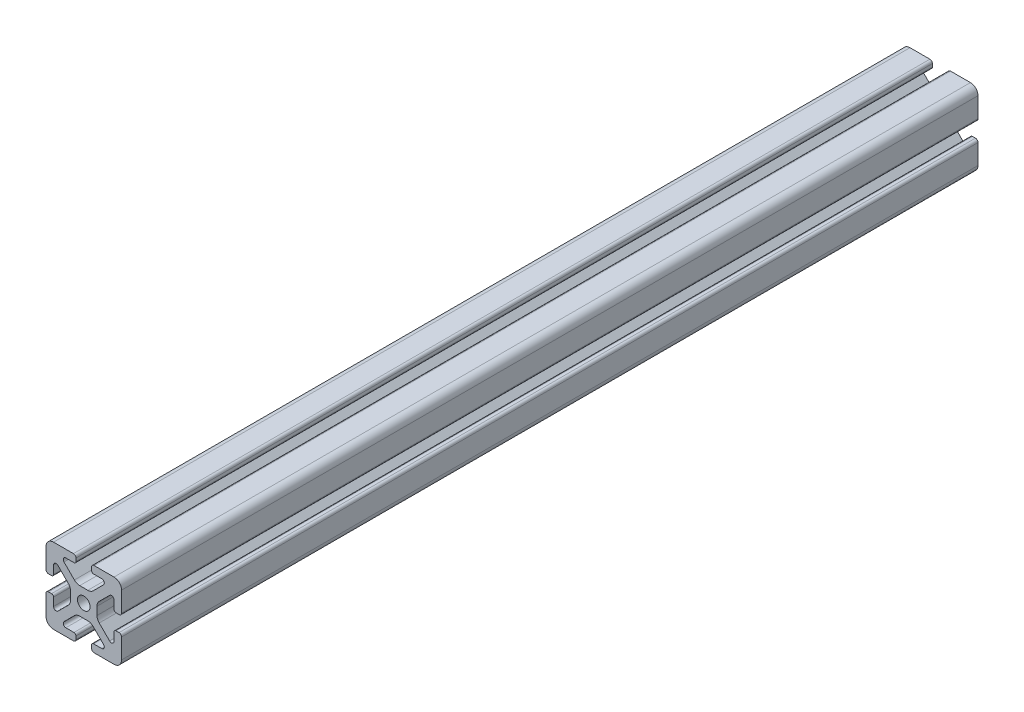
from build123d import *

# Parameters (mm, degrees)
BOSS_EXTRU_1_DEPTH = 340


with BuildPart() as part:
    # Esquisse1 → Boss.-Extru.1 (new body)
    with BuildSketch(Plane.XY):
        with BuildLine():
            Line((-5.250000005, 1.60319626), (-5.250000005, -1.60319626))
            ThreePointArc((-5.250000005, -1.60319626), (-5.478361407, -2.751246556), (-6.128679661, -3.724516602))
            Line((-6.128679661, -3.724516602), (-10.254720421, -7.850557362))
            ThreePointArc((-10.254720421, -7.850557362), (-11.36887955, -8.072177392), (-12, -7.12763889))
            Line((-12, -7.12763889), (-12, -3.9))
            ThreePointArc((-12, -3.9), (-12.234314575, -3.334314575), (-12.8, -3.1))
            Line((-12.8, -3.1), (-14, -3.1))
            ThreePointArc((-14, -3.1), (-14.707106781, -3.392893219), (-15, -4.1))
            Line((-15, -4.1), (-15, -12))
            ThreePointArc((-15, -12), (-14.121320344, -14.121320344), (-12, -15))
            Line((-12, -15), (-4.1, -15))
            ThreePointArc((-4.1, -15), (-3.392893219, -14.707106781), (-3.1, -14))
            Line((-3.1, -14), (-3.1, -12.8))
            ThreePointArc((-3.1, -12.8), (-3.334314575, -12.234314575), (-3.9, -12))
            Line((-3.9, -12), (-7.12763889, -12))
            ThreePointArc((-7.12763889, -12), (-8.072177392, -11.36887955), (-7.850557362, -10.254720421))
            Line((-7.850557362, -10.254720421), (-3.724516602, -6.128679661))
            ThreePointArc((-3.724516602, -6.128679661), (-2.751246556, -5.478361407), (-1.60319626, -5.250000005))
            Line((-1.60319626, -5.250000005), (1.60319626, -5.250000005))
            ThreePointArc((1.60319626, -5.250000005), (2.751246556, -5.478361407), (3.724516602, -6.128679661))
            Line((3.724516602, -6.128679661), (7.850557362, -10.254720421))
            ThreePointArc((7.850557362, -10.254720421), (8.072177392, -11.36887955), (7.12763889, -12))
            Line((7.12763889, -12), (3.9, -12))
            ThreePointArc((3.9, -12), (3.334314575, -12.234314575), (3.1, -12.8))
            Line((3.1, -12.8), (3.1, -14))
            ThreePointArc((3.1, -14), (3.392893219, -14.707106781), (4.1, -15))
            Line((4.1, -15), (12, -15))
            ThreePointArc((12, -15), (14.121320343, -14.121320344), (15, -12))
            Line((15, -12), (15, -4.1))
            ThreePointArc((15, -4.1), (14.707106781, -3.392893219), (14, -3.1))
            Line((14, -3.1), (12.8, -3.1))
            ThreePointArc((12.8, -3.1), (12.234314575, -3.334314575), (12, -3.9))
            Line((12, -3.9), (12, -7.12763889))
            ThreePointArc((12, -7.12763889), (11.36887955, -8.072177392), (10.254720421, -7.850557362))
            Line((10.254720421, -7.850557362), (6.128679661, -3.724516602))
            ThreePointArc((6.128679661, -3.724516602), (5.478361407, -2.751246556), (5.250000005, -1.60319626))
            Line((5.250000005, -1.60319626), (5.250000005, 1.60319626))
            ThreePointArc((5.250000005, 1.60319626), (5.478361407, 2.751246556), (6.128679661, 3.724516602))
            Line((6.128679661, 3.724516602), (10.254720421, 7.850557362))
            ThreePointArc((10.254720421, 7.850557362), (11.36887955, 8.072177392), (12, 7.12763889))
            Line((12, 7.12763889), (12, 3.9))
            ThreePointArc((12, 3.9), (12.234314575, 3.334314575), (12.8, 3.1))
            Line((12.8, 3.1), (14, 3.1))
            ThreePointArc((14, 3.1), (14.707106781, 3.392893219), (15, 4.1))
            Line((15, 4.1), (15, 12))
            ThreePointArc((15, 12), (14.121320343, 14.121320343), (12, 15))
            Line((12, 15), (4.1, 15))
            ThreePointArc((4.1, 15), (3.392893219, 14.707106781), (3.1, 14))
            Line((3.1, 14), (3.1, 12.8))
            ThreePointArc((3.1, 12.8), (3.334314575, 12.234314575), (3.9, 12))
            Line((3.9, 12), (7.12763889, 12))
            ThreePointArc((7.12763889, 12), (8.072177392, 11.36887955), (7.850557362, 10.254720421))
            Line((7.850557362, 10.254720421), (3.724516602, 6.128679661))
            ThreePointArc((3.724516602, 6.128679661), (2.751246556, 5.478361407), (1.60319626, 5.250000005))
            Line((1.60319626, 5.250000005), (-1.60319626, 5.250000005))
            ThreePointArc((-1.60319626, 5.250000005), (-2.751246556, 5.478361407), (-3.724516602, 6.128679661))
            Line((-3.724516602, 6.128679661), (-7.850557362, 10.254720421))
            ThreePointArc((-7.850557362, 10.254720421), (-8.072177392, 11.36887955), (-7.12763889, 12))
            Line((-7.12763889, 12), (-3.9, 12))
            ThreePointArc((-3.9, 12), (-3.334314575, 12.234314575), (-3.1, 12.8))
            Line((-3.1, 12.8), (-3.1, 14))
            ThreePointArc((-3.1, 14), (-3.392893219, 14.707106781), (-4.1, 15))
            Line((-4.1, 15), (-12, 15))
            ThreePointArc((-12, 15), (-14.121320344, 14.121320343), (-15, 12))
            Line((-15, 12), (-15, 4.1))
            ThreePointArc((-15, 4.1), (-14.707106781, 3.392893219), (-14, 3.1))
            Line((-14, 3.1), (-12.8, 3.1))
            ThreePointArc((-12.8, 3.1), (-12.234314575, 3.334314575), (-12, 3.9))
            Line((-12, 3.9), (-12, 7.12763889))
            ThreePointArc((-12, 7.12763889), (-11.36887955, 8.072177392), (-10.254720421, 7.850557362))
            Line((-10.254720421, 7.850557362), (-6.128679661, 3.724516602))
            ThreePointArc((-6.128679661, 3.724516602), (-5.478361407, 2.751246556), (-5.250000005, 1.60319626))
        make_face()
        with BuildLine():
            ThreePointArc((-2.5, 0), (0, -2.5), (2.5, 0))
            ThreePointArc((2.5, 0), (0, 2.5), (-2.5, 0))
        make_face(mode=Mode.SUBTRACT)
    extrude(amount=BOSS_EXTRU_1_DEPTH)


solid = part.part
